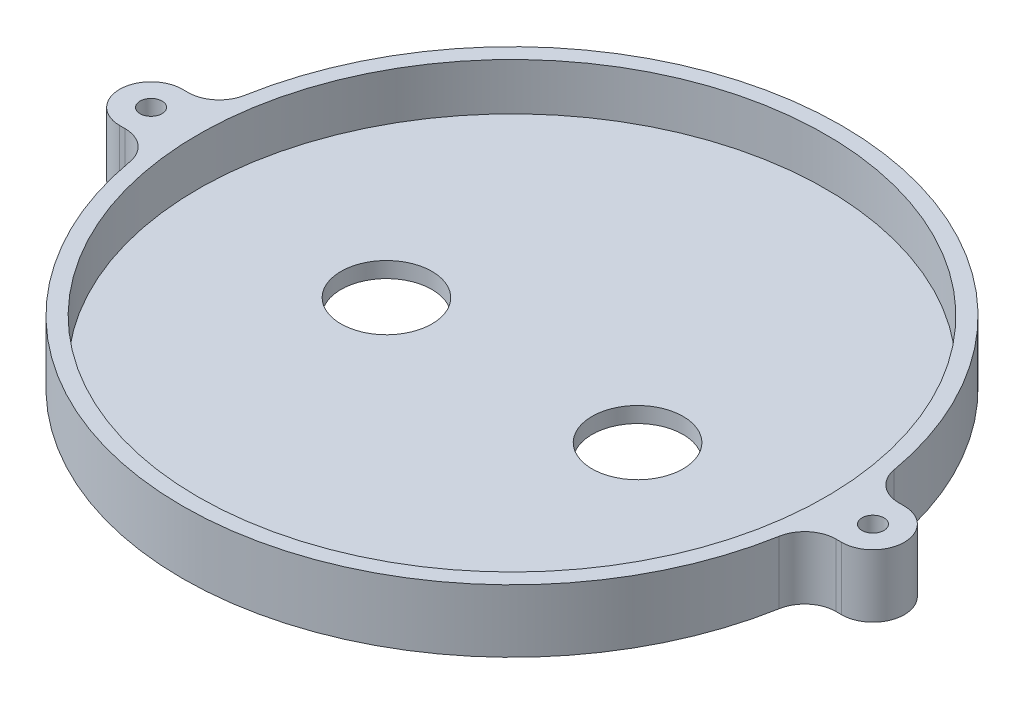
from build123d import *

# Parameters (mm, degrees)
SKETCH1_R           = 52.5
SKETCH1_R_2         = 50
BOSS_EXTRUDE1_DEPTH = 7.5
BOSS_EXTRUDE2_START = 2.5
SKETCH2_R           = 52.5
BOSS_EXTRUDE2_DEPTH = 2.5
SKETCH3_R           = 7.25
CUT_EXTRUDE1_DEPTH  = 75.916620319
SKETCH4_R           = 1.75
BOSS_EXTRUDE3_DEPTH = 10
FILLET1_R           = 5


with BuildPart() as part:
    # Sketch1 → Boss-Extrude1 (new body)
    with BuildSketch(Plane(origin=(0, 0, 0), x_dir=(1, 0, 0), z_dir=(0, 1, 0))):
        with Locations(Location((0, 0, 0), (0, 0, 270))):
            Circle(SKETCH1_R)
        with Locations(Location((0, 0, 0), (0, 0, 270))):
            Circle(SKETCH1_R_2, mode=Mode.SUBTRACT)
    extrude(amount=BOSS_EXTRUDE1_DEPTH)

    # Sketch2 → Boss-Extrude2 (add)
    with BuildSketch(Plane.XZ.offset(BOSS_EXTRUDE2_START)):
        with Locations(Location((0, 0, 0), (0, 0, 270))):
            Circle(SKETCH2_R)
    extrude(amount=-BOSS_EXTRUDE2_DEPTH)

    # Sketch3 → Cut-Extrude1 (cut, through all)
    with BuildSketch(Plane.XZ.offset(2.5)):
        with Locations(Location((20, 0, 0), (0, 0, 270))):
            Circle(SKETCH3_R)
        with Locations(Location((-20, 0, 0), (0, 0, 270))):
            Circle(SKETCH3_R)
    extrude(amount=-CUT_EXTRUDE1_DEPTH, mode=Mode.SUBTRACT)

    # Sketch4 → Boss-Extrude3 (add)
    with BuildSketch(Plane.XZ.offset(2.5)):
        with BuildLine():
            Line((-57.5, 5), (-52.261362401, 5))
            Line((-52.261362401, 5), (-51.658599185, 0))
            Line((-51.658599185, 0), (-52.261362401, -5))
            Line((-52.261362401, -5), (-57.5, -5))
            ThreePointArc((-57.5, -5), (-62.5, 0), (-57.5, 5))
        make_face()
        with Locations(Location((-57.5, 0, 0), (0, 0, 270))):
            Circle(SKETCH4_R, mode=Mode.SUBTRACT)
    boss_extrude3 = extrude(amount=-BOSS_EXTRUDE3_DEPTH)

    # Mirror1: Boss-Extrude3 across plane
    add(boss_extrude3.mirror(Plane(origin=(0, 0, 0), x_dir=(0, 0, 1), z_dir=(1, 0, 0))))

    # Fillet1
    fillet1_edges = [part.edges().sort_by_distance(p)[0] for p in [
        (-52.261362401, 2.5, 5),
        (-52.261362401, 2.5, -5),
        (52.261362401, 2.5, 5),
        (52.261362401, 2.5, -5),
    ]]
    fillet(fillet1_edges, radius=FILLET1_R)


solid = part.part
